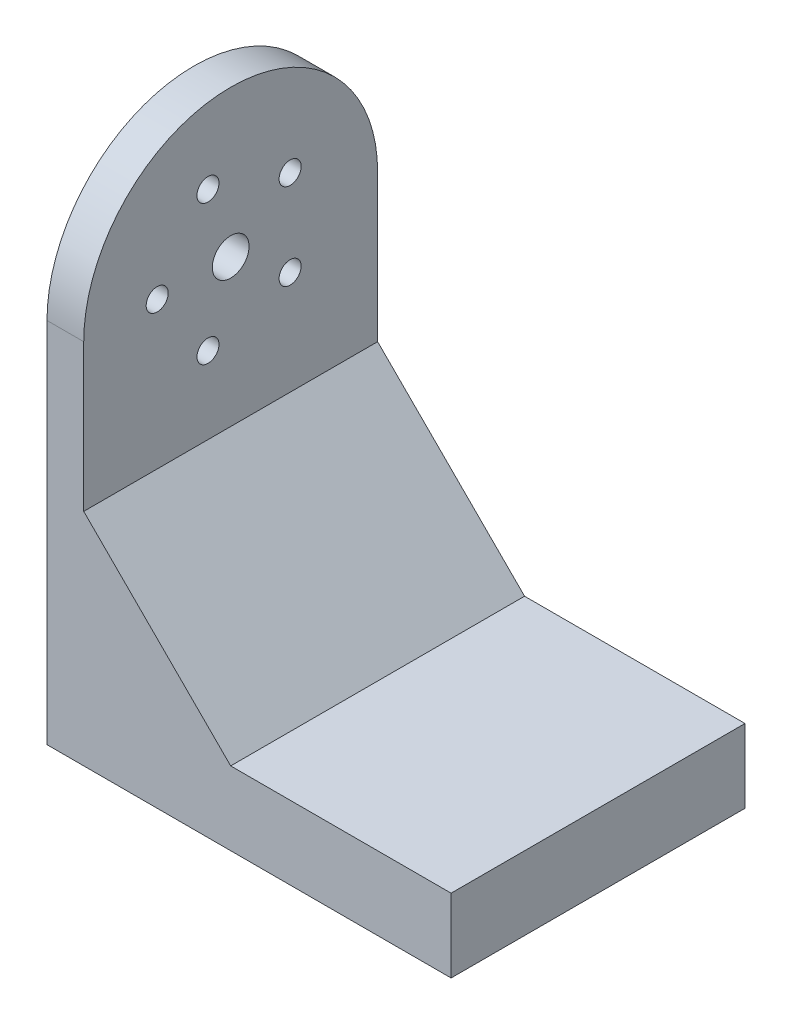
from build123d import *

# Parameters (mm, degrees)
SKETCH1_R            = 1.5
SKETCH1_R_2          = 2.5
BOSS_EXTRUDE11_DEPTH = 5
SKETCH2_W            = 40
SKETCH2_H            = 10
BOSS_EXTRUDE12_DEPTH = 50
CHAMFER1_SIZE        = 20


with BuildPart() as part:
    # Sketch1 → Boss-Extrude11 (new body)
    with BuildSketch(Plane(origin=(0, 0, 0), x_dir=(0, 0, -1), z_dir=(1, 0, 0))):
        with BuildLine():
            Line((-20, 0), (-20, -50))
            Line((-20, -50), (20, -50))
            Line((20, -50), (20, 0))
            ThreePointArc((20, 0), (0, 20), (-20, 0))
        make_face()
        with Locations((-10, 0)):
            Circle(SKETCH1_R, mode=Mode.SUBTRACT)
        Circle(SKETCH1_R_2, mode=Mode.SUBTRACT)
        with Locations((8.090169944, -5.877852523)):
            Circle(SKETCH1_R, mode=Mode.SUBTRACT)
        with Locations((-3.090169944, -9.510565163)):
            Circle(SKETCH1_R, mode=Mode.SUBTRACT)
        with Locations((8.090169944, 5.877852523)):
            Circle(SKETCH1_R, mode=Mode.SUBTRACT)
        with Locations((-3.090169944, 9.510565163)):
            Circle(SKETCH1_R, mode=Mode.SUBTRACT)
    extrude(amount=BOSS_EXTRUDE11_DEPTH)

    # Sketch2 → Boss-Extrude12 (add)
    with BuildSketch(Plane(origin=(5, 0, 0), x_dir=(0, 0, -1), z_dir=(1, 0, 0))):
        with Locations((0, -45)):
            Rectangle(SKETCH2_W, SKETCH2_H)
    extrude(amount=BOSS_EXTRUDE12_DEPTH)

    # Chamfer1
    chamfer1_edges = [part.edges().sort_by_distance(p)[0] for p in [
        (5, -40, 0),
    ]]
    chamfer(chamfer1_edges, length=CHAMFER1_SIZE)


solid = part.part
